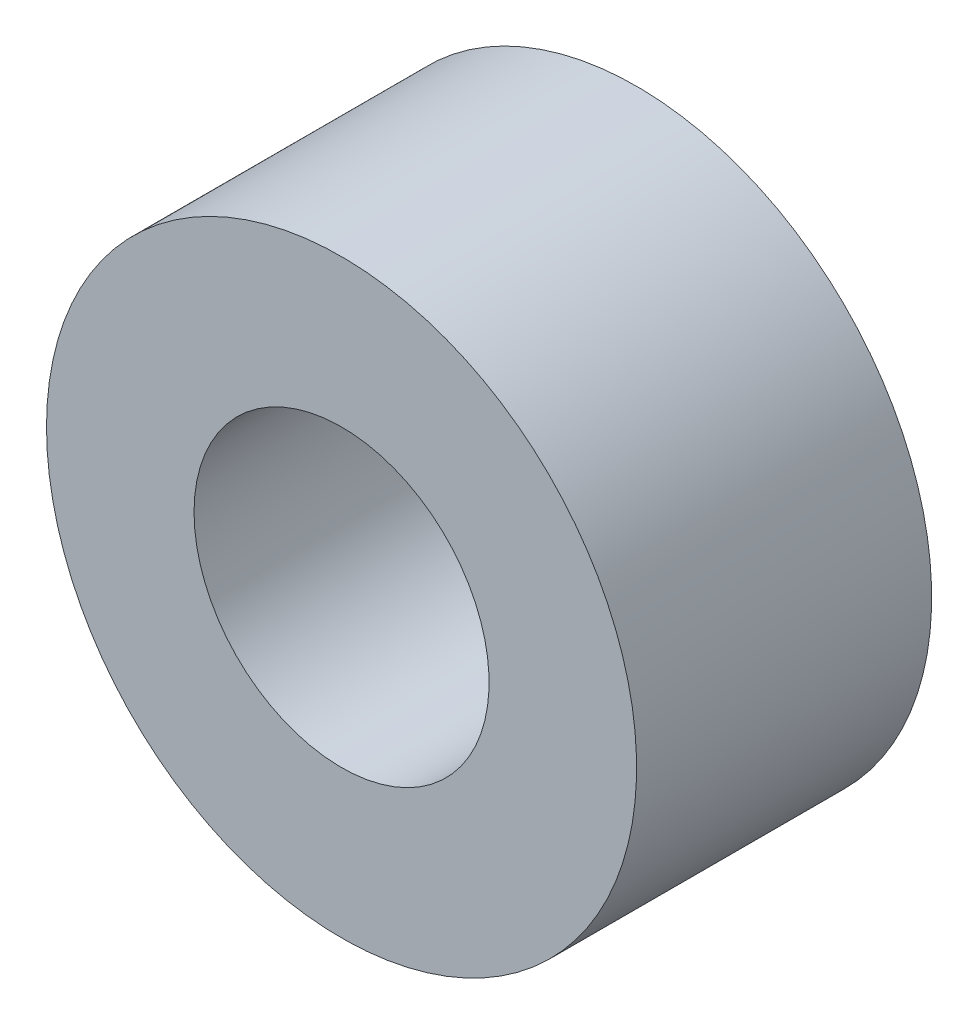
from build123d import *

# Parameters (mm, degrees)
SKETCH2_W = 5
SKETCH2_H = 2.5


with BuildPart() as part:
    # Sketch2 → Revolve1 (revolve)
    with BuildSketch(Plane(origin=(0, 0, 0), x_dir=(0, 0, -1), z_dir=(1, 0, 0)), mode=Mode.PRIVATE) as revolve1_sk:
        with Locations((0, 3.75)):
            Rectangle(SKETCH2_W, SKETCH2_H)
    revolve(revolve1_sk.sketch.rotate(Axis((0, 0, 0), (0, 0, 1)), 90), axis=Axis((0, 0, 0), (0, 0, 1)))


solid = part.part
